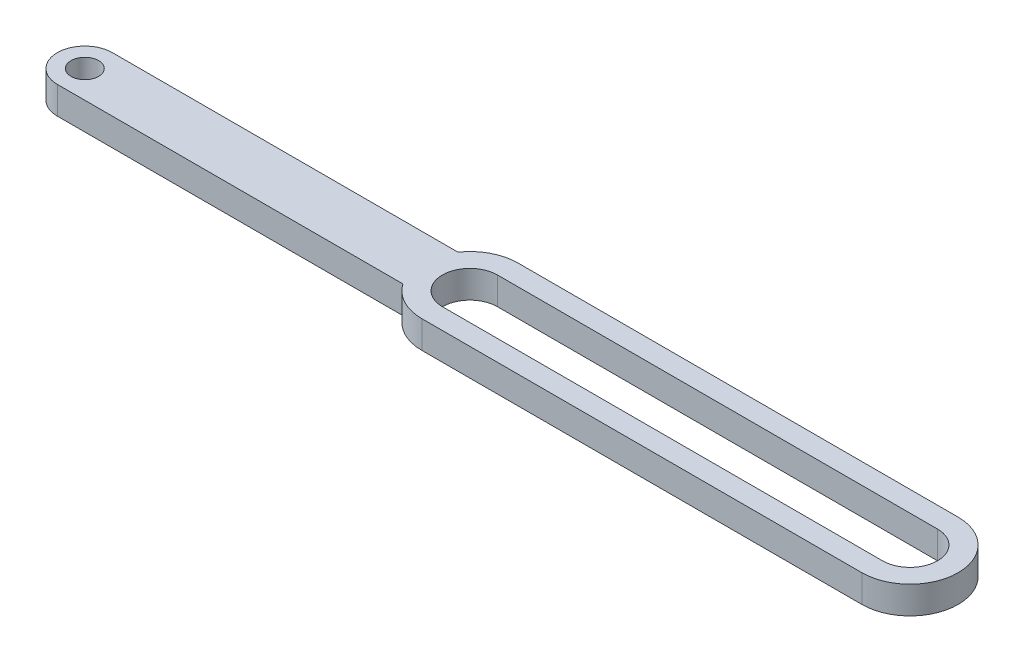
from build123d import *

# Parameters (mm, degrees)
SKETCH_1_R      = 1
EXTRUDE_1_DEPTH = 2


with BuildPart() as part:
    # 草图1 → 凸台-拉伸1 (new body)
    with BuildSketch(Plane(origin=(0, 0, 0), x_dir=(1, 0, 0), z_dir=(0, 1, 0))):
        with BuildLine():
            Line((-30, 2), (-4.872281323, 2))
            ThreePointArc((-4.872281323, 2), (-3.620185175, 3.102418411), (-2, 3.5))
            Line((-2, 3.5), (30, 3.5))
            ThreePointArc((30, 3.5), (33.5, 0), (30, -3.5))
            Line((30, -3.5), (-2, -3.5))
            ThreePointArc((-2, -3.5), (-3.620185175, -3.102418411), (-4.872281323, -2))
            Line((-4.872281323, -2), (-30, -2))
            ThreePointArc((-30, -2), (-32, 0), (-30, 2))
        make_face()
        with Locations(Location((-30, 0, 0), (0, 0, 270))):
            Circle(SKETCH_1_R, mode=Mode.SUBTRACT)
        with BuildLine():
            Line((-2, 2), (30, 2))
            ThreePointArc((30, 2), (32, 0), (30, -2))
            Line((30, -2), (-2, -2))
            ThreePointArc((-2, -2), (-4, 0), (-2, 2))
        make_face(mode=Mode.SUBTRACT)
    extrude(amount=EXTRUDE_1_DEPTH)


solid = part.part
